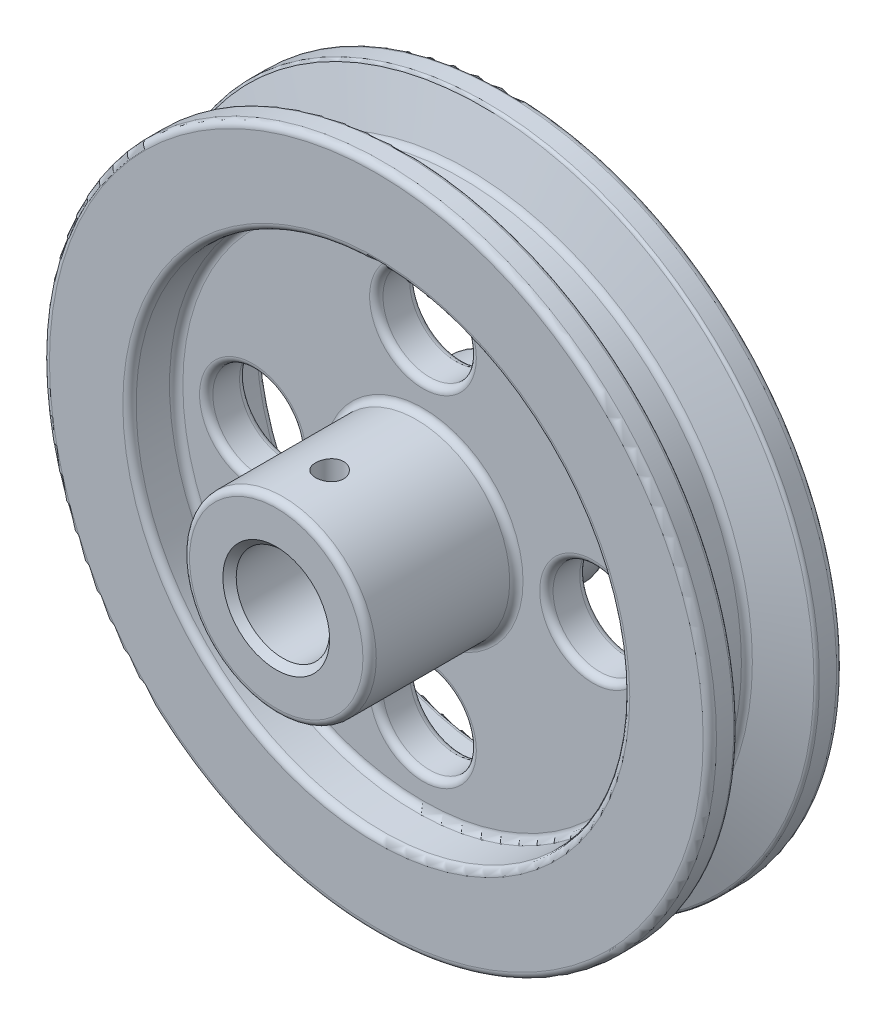
from build123d import *

# Parameters (mm, degrees)
SKETCH_4_R              = 7
CUT_EXTRUDE_1_DEPTH     = 75.054034326
CHAMFER_1_SIZE          = 1
HOLE_WIZARD_M5_1_REACH  = 88.238
HOLE_WIZARD_M5_1_BORE_R = 2.1
FILLET_1_R              = 1
FILLET_2_R              = 0.5


with BuildPart() as part:
    # 草圖1 → 旋轉1 (revolve)
    with BuildSketch(Plane(origin=(0, 0, 0), x_dir=(0, 0, -1), z_dir=(1, 0, 0)), mode=Mode.PRIVATE) as revolve_1_sk:
        Polygon((-3, 14), (-3, 37), (-10, 37), (-10, 50), (10, 50), (10, 37), (3, 37), (3, 14), (12, 14), (12, 7), (-25, 7), (-25, 14), align=None)
    revolve(revolve_1_sk.sketch.rotate(Axis((0, 0, 0), (0, 0, 1)), 90), axis=Axis((0, 0, 0), (0, 0, 1)))

    # 草圖3 → 除料-旋轉1 (revolve, cut)
    with BuildSketch(Plane(origin=(0, 0, 0), x_dir=(0, 0, -1), z_dir=(1, 0, 0)), mode=Mode.PRIVATE) as cut_revolve_1_sk:
        Polygon((-6.062138633, 50), (6.062138633, 50), (3.462781063, 42), (-3.462781063, 42), align=None)
    revolve(cut_revolve_1_sk.sketch.rotate(Axis((0, 0, 0), (0, 0, -1)), 90), axis=Axis((0, 0, 0), (0, 0, -1)), mode=Mode.SUBTRACT)

    # 草圖4 → 除料-伸長1 (cut, through all)
    with BuildSketch(Plane.XY.offset(3)):
        with Locations((0, 25.5)):
            Circle(SKETCH_4_R)
        with Locations((25.5, 0)):
            Circle(SKETCH_4_R)
        with Locations((0, -25.5)):
            Circle(SKETCH_4_R)
        with Locations((-25.5, 0)):
            Circle(SKETCH_4_R)
    extrude(amount=-CUT_EXTRUDE_1_DEPTH, mode=Mode.SUBTRACT)

    # 導角1
    chamfer_1_edges = [part.edges().sort_by_distance(p)[0] for p in [
        (7, 0, 25),
    ]]
    chamfer(chamfer_1_edges, length=CHAMFER_1_SIZE)

    # M5 螺紋孔1 bore (on position points) → M5 螺紋孔1 (cut, up to next)
    with BuildSketch(Plane(origin=(0, 14, 17), x_dir=(1, 0, 0), z_dir=(0, 1, 0)), mode=Mode.PRIVATE) as hole_wizard_m5_1_sk1:
        Circle(HOLE_WIZARD_M5_1_BORE_R)
    hole_wizard_m5_1_tool1 = extrude(hole_wizard_m5_1_sk1.sketch, amount=-HOLE_WIZARD_M5_1_REACH, mode=Mode.PRIVATE) & part.part
    add(hole_wizard_m5_1_tool1.solids().sort_by_distance((0, 14, 17))[0], mode=Mode.SUBTRACT)

    # 圓角1
    fillet_1_edges = [part.edges().sort_by_distance(p)[0] for p in [
        (50, 0, -10),
        (50, 0, 10),
        (37, 0, 10),
        (37, 0, 3),
        (14, 0, 3),
        (14, 0, 25),
        (-42, 0, -3.462781063),
        (-42, 0, 3.462781063),
        (-7, 25.5, -3),
        (-7, 25.5, 3),
        (18.5, 0, -3),
        (18.5, 0, 3),
        (-7, -25.5, -3),
        (-7, -25.5, 3),
        (-32.5, 0, -3),
        (-32.5, 0, 3),
        (14, 0, -12),
        (14, 0, -3),
        (37, 0, -3),
        (37, 0, -10),
    ]]
    fillet(fillet_1_edges, radius=FILLET_1_R)

    # 圓角2
    fillet_2_edges = [part.edges().sort_by_distance(p)[0] for p in [
        (0, -50, 6.062138633),
        (0, -50, -6.062138633),
    ]]
    fillet(fillet_2_edges, radius=FILLET_2_R)


solid = part.part
